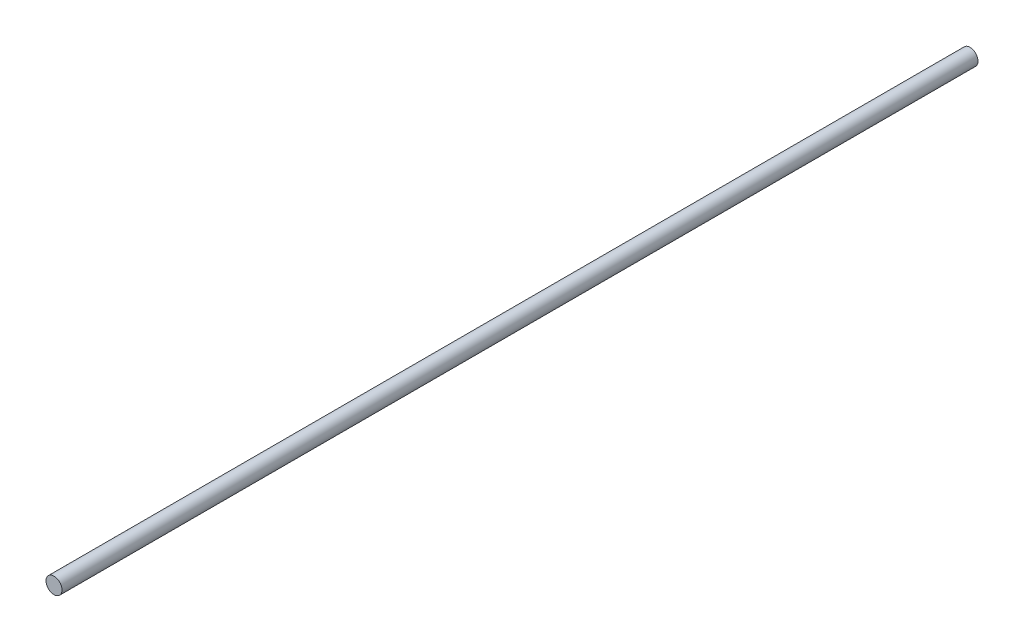
from build123d import *

# Parameters (mm, degrees)
SKETCH1_R           = 4
BOSS_EXTRUDE1_DEPTH = 457


with BuildPart() as part:
    # Sketch1 → Boss-Extrude1 (new body)
    with BuildSketch(Plane.XY):
        Circle(SKETCH1_R)
    extrude(amount=BOSS_EXTRUDE1_DEPTH)


solid = part.part
